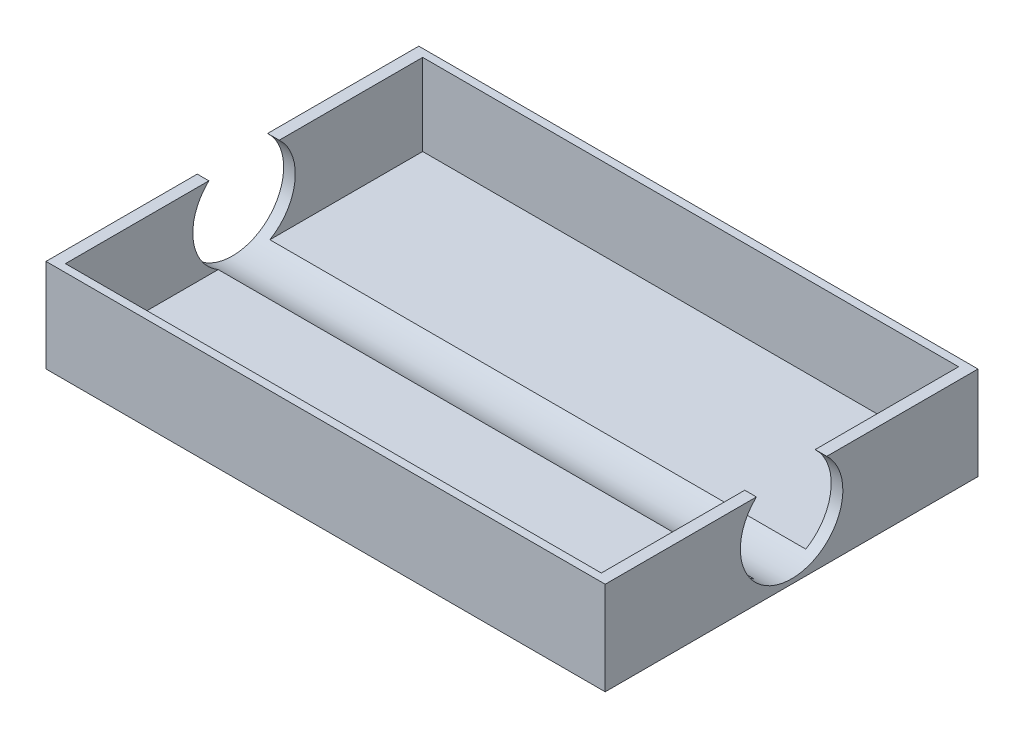
from build123d import *

# Parameters (mm, degrees)
SKETCH1_W           = 120
SKETCH1_H           = 80
SKETCH1_W_2         = 115
SKETCH1_H_2         = 76.666666666
BOSS_EXTRUDE1_DEPTH = 20
SKETCH1_3_W         = 115
SKETCH1_3_H         = 76.666666666
BOSS_EXTRUDE2_DEPTH = 2.5
SKETCH2_R           = 11
CUT_EXTRUDE1_DEPTH  = 129.062484749


with BuildPart() as part:
    # Sketch1 → Boss-Extrude1 (new body)
    with BuildSketch(Plane(origin=(0, 0, 0), x_dir=(1, 0, 0), z_dir=(0, 1, 0))):
        Rectangle(SKETCH1_W, SKETCH1_H)
        Rectangle(SKETCH1_W_2, SKETCH1_H_2, mode=Mode.SUBTRACT)
    extrude(amount=BOSS_EXTRUDE1_DEPTH)

    # Sketch1<3> → Boss-Extrude2 (add)
    with BuildSketch(Plane(origin=(0, 0, 0), x_dir=(1, 0, 0), z_dir=(0, 1, 0))):
        Rectangle(SKETCH1_3_W, SKETCH1_3_H)
    extrude(amount=BOSS_EXTRUDE2_DEPTH)

    # Sketch2 → Cut-Extrude1 (cut, through all)
    with BuildSketch(Plane.ZY.offset(60)):
        with Locations((0, 12)):
            Circle(SKETCH2_R)
    extrude(amount=-CUT_EXTRUDE1_DEPTH, mode=Mode.SUBTRACT)


solid = part.part
